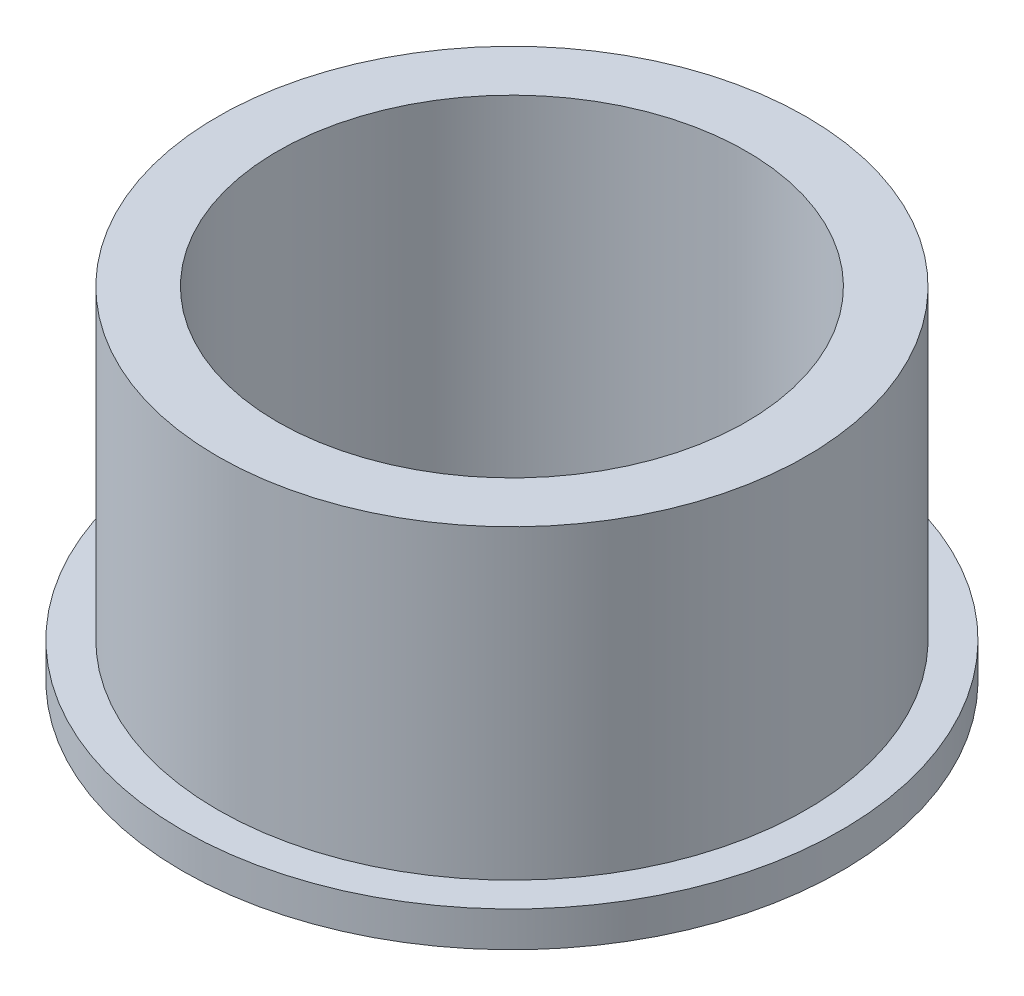
from build123d import *


with BuildPart() as part:
    # Sketch1 → Revolve1 (revolve)
    with BuildSketch(Plane(origin=(0, 0, 0), x_dir=(0, 0, -1), z_dir=(1, 0, 0)), mode=Mode.PRIVATE) as revolve1_sk:
        Polygon((3.0353, 0), (4.2672, 0), (4.2672, 0.4572), (3.81, 0.4572), (3.81, 4.4196), (3.0353, 4.4196), align=None)
    revolve(revolve1_sk.sketch.rotate(Axis((0, 7.412856612, 0), (0, -1, 0)), 180), axis=Axis((0, 7.412856612, 0), (0, -1, 0)))


solid = part.part
